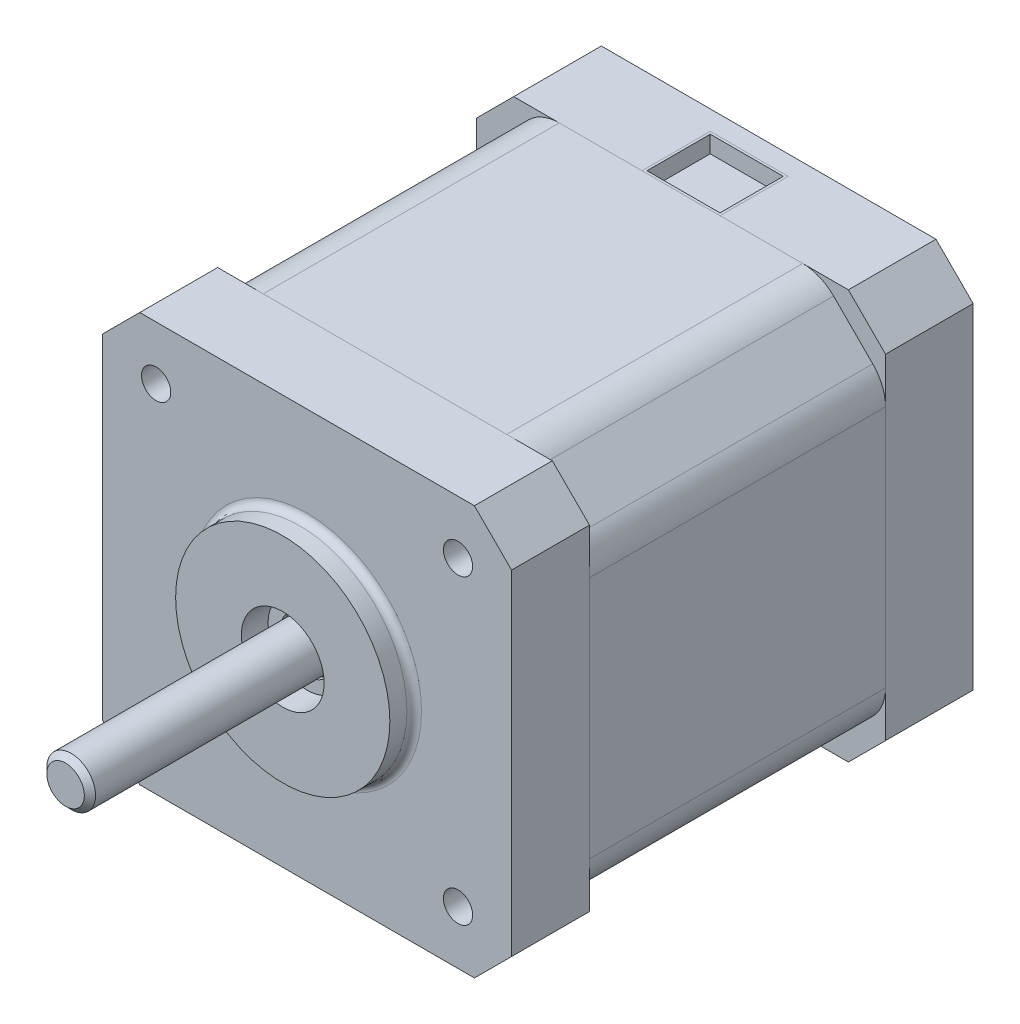
from build123d import *

# Parameters (mm, degrees)
BOSS_EXTRUDE1_DEPTH = 8
BOSS_EXTRUDE2_DEPTH = 30.4
BOSS_EXTRUDE3_DEPTH = 9
SKETCH5_R           = 1.5
CUT_EXTRUDE1_DEPTH  = 4.5
SKETCH6_R           = 11
BOSS_EXTRUDE4_DEPTH = 2.5
SKETCH9_R           = 4.25
CUT_EXTRUDE2_DEPTH  = 3
SKETCH8_R           = 2.5
BOSS_EXTRUDE5_DEPTH = 25.3
SKETCH11_R          = 4
SKETCH11_R_2        = 2.75
BOSS_EXTRUDE6_DEPTH = 0.5
FILLET1_R           = 0.75
SKETCH13_W          = 8
SKETCH13_H          = 7
CUT_EXTRUDE3_DEPTH  = 2
SKETCH14_W          = 8
SKETCH14_H          = 7
BOSS_EXTRUDE7_DEPTH = 0.25
SKETCH15_W          = 8
SKETCH15_H          = 7
SKETCH15_W_2        = 7.5
SKETCH15_H_2        = 6.5
BOSS_EXTRUDE8_DEPTH = 1.75


with BuildPart() as part:
    # Sketch1 → Boss-Extrude1 (new body)
    with BuildSketch(Plane.XY):
        Polygon((17.183766184, 21), (-17.183766184, 21), (-21, 17.183766184), (-21, -17.183766184), (-17.183766184, -21), (17.183766184, -21), (21, -17.183766184), (21, 17.183766184), align=None)
    extrude(amount=-BOSS_EXTRUDE1_DEPTH)

    # Sketch5 → Cut-Extrude1 (cut)
    with BuildSketch(Plane.XY):
        with Locations((-15.5, 15.5)):
            Circle(SKETCH5_R)
        with Locations((15.5, 15.5)):
            Circle(SKETCH5_R)
        with Locations((15.5, -15.5)):
            Circle(SKETCH5_R)
        with Locations((-15.5, -15.5)):
            Circle(SKETCH5_R)
    extrude(amount=-CUT_EXTRUDE1_DEPTH, mode=Mode.SUBTRACT)

    # Sketch6 → Boss-Extrude4 (add)
    with BuildSketch(Plane.XY):
        with Locations(Location((0, 0, 0), (0, 0, 180))):
            Circle(SKETCH6_R)
    extrude(amount=BOSS_EXTRUDE4_DEPTH)

    # Sketch9 → Cut-Extrude2 (cut)
    with BuildSketch(Plane.XY.offset(2.5)):
        Circle(SKETCH9_R)
    extrude(amount=-CUT_EXTRUDE2_DEPTH, mode=Mode.SUBTRACT)

    # Sketch11 → Boss-Extrude6 (add)
    with BuildSketch(Plane.XY.offset(-0.5)):
        Circle(SKETCH11_R)
        Circle(SKETCH11_R_2, mode=Mode.SUBTRACT)
    extrude(amount=BOSS_EXTRUDE6_DEPTH)

    # Fillet1
    fillet1_edges = [part.edges().sort_by_distance(p)[0] for p in [
        (11, 0, 0),
    ]]
    fillet(fillet1_edges, radius=FILLET1_R)


with BuildPart() as body_2:
    # Sketch3 → Boss-Extrude2 (new body)
    with BuildSketch(Plane(origin=(0, 0, -8), x_dir=(-1, 0, 0), z_dir=(0, 0, -1))):
        with BuildLine():
            Line((-19.68807717, 15.66726189), (-15.66726189, 19.68807717))
            ThreePointArc((-15.66726189, 19.68807717), (-14.214109783, 20.659042365), (-12.5, 21))
            Line((-12.5, 21), (12.5, 21))
            ThreePointArc((12.5, 21), (14.214109783, 20.659042365), (15.66726189, 19.68807717))
            Line((15.66726189, 19.68807717), (19.68807717, 15.66726189))
            ThreePointArc((19.68807717, 15.66726189), (20.659042365, 14.214109783), (21, 12.5))
            Line((21, 12.5), (21, -12.5))
            ThreePointArc((21, -12.5), (20.659042365, -14.214109783), (19.68807717, -15.66726189))
            Line((19.68807717, -15.66726189), (15.66726189, -19.68807717))
            ThreePointArc((15.66726189, -19.68807717), (14.214109783, -20.659042365), (12.5, -21))
            Line((12.5, -21), (-12.5, -21))
            ThreePointArc((-12.5, -21), (-14.214109783, -20.659042365), (-15.66726189, -19.68807717))
            Line((-15.66726189, -19.68807717), (-19.68807717, -15.66726189))
            ThreePointArc((-19.68807717, -15.66726189), (-20.659042365, -14.214109783), (-21, -12.5))
            Line((-21, -12.5), (-21, 12.5))
            ThreePointArc((-21, 12.5), (-20.659042365, 14.214109783), (-19.68807717, 15.66726189))
        make_face()
    extrude(amount=BOSS_EXTRUDE2_DEPTH)


with BuildPart() as body_3:
    # Sketch4 → Boss-Extrude3 (new body)
    with BuildSketch(Plane(origin=(0, 0, -38.4), x_dir=(-1, 0, 0), z_dir=(0, 0, -1))):
        Polygon((-17.183766184, 21), (-21, 17.183766184), (-21, -17.183766184), (-17.183766184, -21), (17.183766184, -21), (21, -17.183766184), (21, 17.183766184), (17.183766184, 21), align=None)
    extrude(amount=BOSS_EXTRUDE3_DEPTH)

    # Sketch13 → Cut-Extrude3 (cut)
    with BuildSketch(Plane(origin=(0, 21, 0), x_dir=(1, 0, 0), z_dir=(0, 1, 0))):
        with Locations((0, 41.9)):
            Rectangle(SKETCH13_W, SKETCH13_H)
    extrude(amount=-CUT_EXTRUDE3_DEPTH, mode=Mode.SUBTRACT)


with BuildPart() as body_4:
    # Sketch8 → Boss-Extrude5 (new body)
    with BuildSketch(Plane.XY.offset(-0.5)):
        Circle(SKETCH8_R)
    extrude(amount=BOSS_EXTRUDE5_DEPTH)

    # Sketch12 → Cut-Revolve1 (revolve, cut)
    with BuildSketch(Plane(origin=(0, 0, 0), x_dir=(0, 0, -1), z_dir=(1, 0, 0)), mode=Mode.PRIVATE) as cut_revolve1_sk:
        Polygon((-24.8, 1.925), (-24.225, 2.5), (-24.8, 2.5), align=None)
    revolve(cut_revolve1_sk.sketch.rotate(Axis((0, 0, 24.8), (0, 0, -1)), 90), axis=Axis((0, 0, 24.8), (0, 0, -1)), mode=Mode.SUBTRACT)


with BuildPart() as body_5:
    # Sketch14 → Boss-Extrude7 (new body)
    with BuildSketch(Plane(origin=(0, 19, 0), x_dir=(1, 0, 0), z_dir=(0, 1, 0))):
        with Locations((0, 41.9)):
            Rectangle(SKETCH14_W, SKETCH14_H)
    extrude(amount=BOSS_EXTRUDE7_DEPTH)

    # Sketch15 → Boss-Extrude8 (add)
    with BuildSketch(Plane(origin=(0, 19.25, 0), x_dir=(1, 0, 0), z_dir=(0, 1, 0))):
        with Locations((0, 41.9)):
            Rectangle(SKETCH15_W, SKETCH15_H)
        with Locations((0, 41.9)):
            Rectangle(SKETCH15_W_2, SKETCH15_H_2, mode=Mode.SUBTRACT)
    extrude(amount=BOSS_EXTRUDE8_DEPTH)


solid = Compound([part.part, body_2.part, body_3.part, body_4.part, body_5.part])
